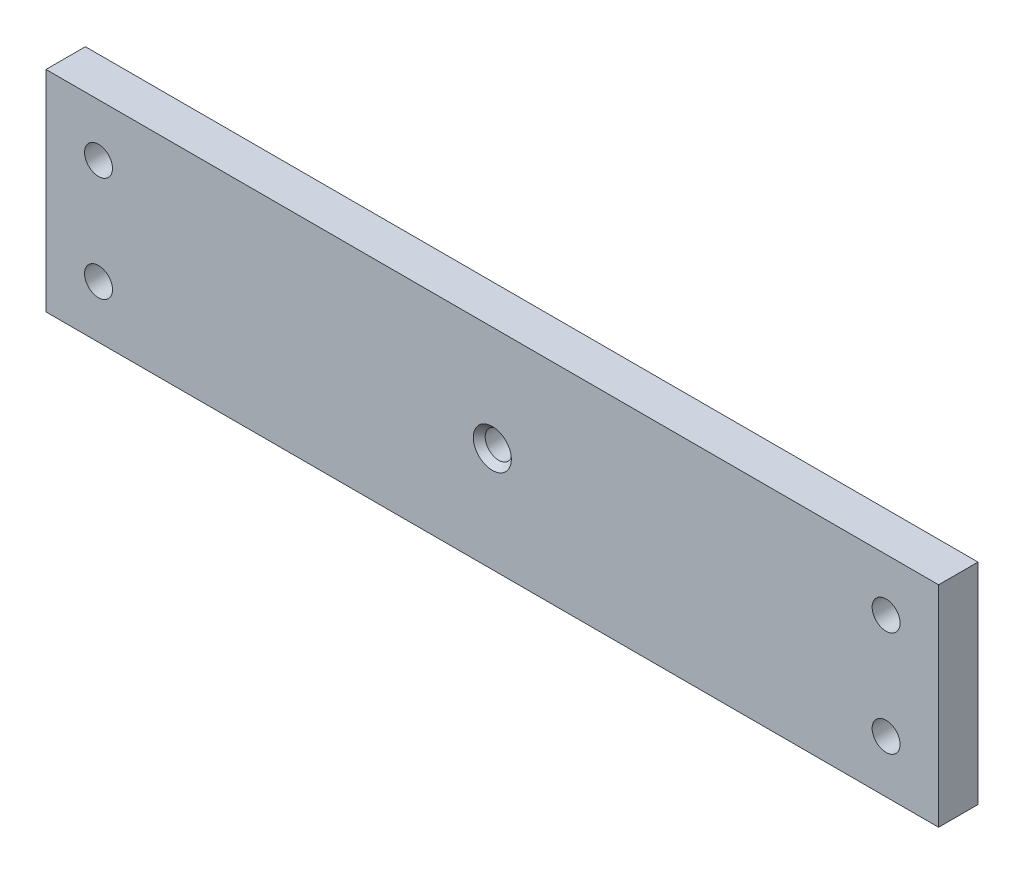
from build123d import *

# Parameters (mm, degrees)
SKETCH1_W                                        = 215.9
SKETCH1_H                                        = 50.8
BOSS_EXTRUDE1_DEPTH                              = 9.525
CSK_FOR_1_4_FLAT_HEAD_MACHINE_SCREW1_D           = 6.7564
CSK_FOR_1_4_FLAT_HEAD_MACHINE_SCREW1_CSINK_D     = 12.8778
CSK_FOR_1_4_FLAT_HEAD_MACHINE_SCREW1_CSINK_ANGLE = 82
F_5_16_18_TAPPED_HOLE1_D                         = 6.5278
F_5_16_18_TAPPED_HOLE1_CSINK_D                   = 9.2075
F_5_16_18_TAPPED_HOLE1_CSINK_ANGLE               = 82


with BuildPart() as part:
    # Sketch1 → Boss-Extrude1 (new body)
    with BuildSketch(Plane.XY):
        Rectangle(SKETCH1_W, SKETCH1_H)
    extrude(amount=BOSS_EXTRUDE1_DEPTH)

    # CSK for 1/4 Flat Head Machine Screw1 (through all)
    with Locations(Plane(origin=(0, 0, 0), x_dir=(-1, 0, 0), z_dir=(0, 0, -1))):
        with Locations((-95.25, 12.7), (-95.25, -12.7), (95.25, 12.7), (95.25, -12.7)):
            CounterSinkHole(CSK_FOR_1_4_FLAT_HEAD_MACHINE_SCREW1_D / 2, CSK_FOR_1_4_FLAT_HEAD_MACHINE_SCREW1_CSINK_D / 2, counter_sink_angle=CSK_FOR_1_4_FLAT_HEAD_MACHINE_SCREW1_CSINK_ANGLE)

    # 5/16-18 Tapped Hole1 (through all)
    with Locations(Plane.XY.offset(9.525)):
        with Locations((0, 0)):
            CounterSinkHole(F_5_16_18_TAPPED_HOLE1_D / 2, F_5_16_18_TAPPED_HOLE1_CSINK_D / 2, counter_sink_angle=F_5_16_18_TAPPED_HOLE1_CSINK_ANGLE)


solid = part.part
